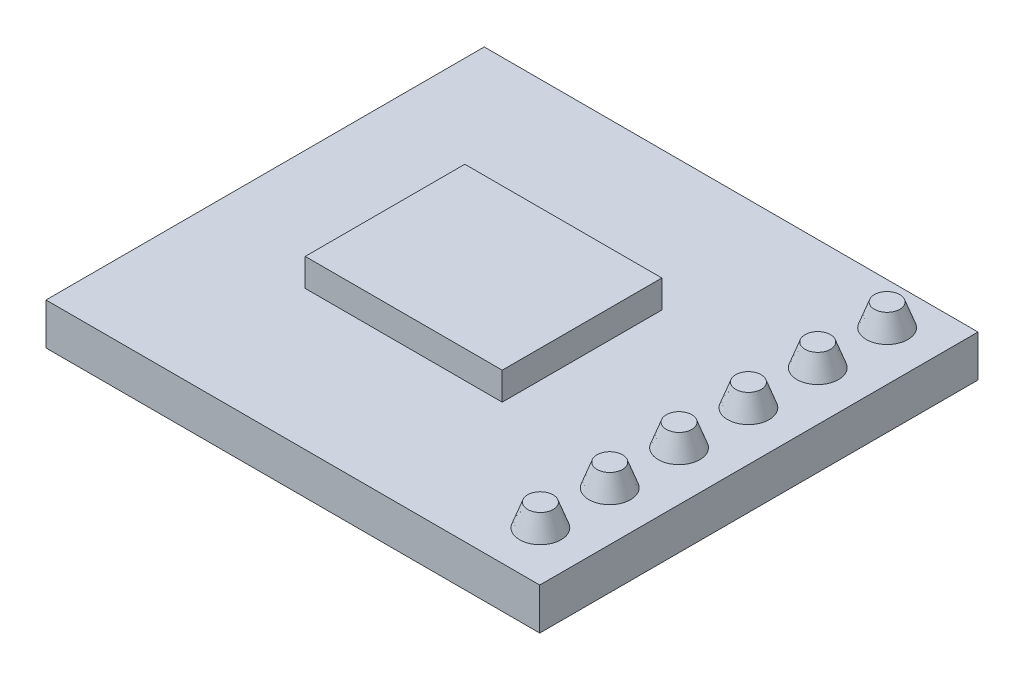
from build123d import *

# Parameters (mm, degrees)
SKETCH1_W                     = 17.8
SKETCH1_H                     = 15.8
BOSS_EXTRUDE1_DEPTH           = 1.5
SKETCH2_W                     = 7.103176806
SKETCH2_H                     = 5.754981775
BOSS_EXTRUDE2_DEPTH           = 1
SKETCH3_R                     = 0.75
BOSS_EXTRUDE3_DEPTH           = 0.8
BOSS_EXTRUDE3_DRAFT           = 20
BOSS_EXTRUDE3_PROFILE_2_DEPTH = 0.8
BOSS_EXTRUDE3_PROFILE_2_DRAFT = 20
BOSS_EXTRUDE3_PROFILE_3_DEPTH = 0.8
BOSS_EXTRUDE3_PROFILE_3_DRAFT = 20
BOSS_EXTRUDE3_PROFILE_4_DEPTH = 0.8
BOSS_EXTRUDE3_PROFILE_4_DRAFT = 20
BOSS_EXTRUDE3_PROFILE_5_DEPTH = 0.8
BOSS_EXTRUDE3_PROFILE_5_DRAFT = 20
BOSS_EXTRUDE3_PROFILE_6_DEPTH = 0.8
BOSS_EXTRUDE3_PROFILE_6_DRAFT = 20


with BuildPart() as part:
    # Sketch1 → Boss-Extrude1 (new body)
    with BuildSketch(Plane(origin=(0, 0, 0), x_dir=(1, 0, 0), z_dir=(0, 1, 0))):
        Rectangle(SKETCH1_W, SKETCH1_H)
    extrude(amount=BOSS_EXTRUDE1_DEPTH)

    # Sketch2 → Boss-Extrude2 (add)
    with BuildSketch(Plane(origin=(0, 1.5, 0), x_dir=(1, 0, 0), z_dir=(0, 1, 0))):
        with Locations((-1.036299166, 0.010061156)):
            Rectangle(SKETCH2_W, SKETCH2_H)
    extrude(amount=BOSS_EXTRUDE2_DEPTH)


with BuildPart() as boss_extrude3_tool:
    # Sketch3 → Boss-Extrude3 (with draft: the straight prism first)
    with BuildSketch(Plane(origin=(0, 1.5, 0), x_dir=(1, 0, 0), z_dir=(0, 1, 0))):
        with Locations((7.12329912, 6.4)):
            Circle(SKETCH3_R)
    extrude(amount=BOSS_EXTRUDE3_DEPTH)
    # Boss-Extrude3: the draft: its side faces are tilted about the plane it starts from
    boss_extrude3_sides = [boss_extrude3_tool.faces().sort_by_distance(p)[0] for p in [
        (6.37329912, 1.9, -6.4),
    ]]
    draft(boss_extrude3_sides, Plane(origin=(0, 1.5, 0), x_dir=(1, 0, 0), z_dir=(0, 1, 0)), BOSS_EXTRUDE3_DRAFT)


with BuildPart() as part_1:
    add(part.part)

    # Boss-Extrude3: add boss_extrude3_tool
    add(boss_extrude3_tool.part)


with BuildPart() as boss_extrude3_profile_2_tool:
    # Sketch3 → Boss-Extrude3 profile 2 (with draft: the straight prism first)
    with BuildSketch(Plane(origin=(0, 1.5, 0), x_dir=(1, 0, 0), z_dir=(0, 1, 0))):
        with Locations((7.12329912, 3.9)):
            Circle(SKETCH3_R)
    extrude(amount=BOSS_EXTRUDE3_PROFILE_2_DEPTH)
    # Boss-Extrude3 profile 2: the draft: its side faces are tilted about the plane it starts from
    boss_extrude3_profile_2_sides = [boss_extrude3_profile_2_tool.faces().sort_by_distance(p)[0] for p in [
        (6.37329912, 1.9, -3.9),
    ]]
    draft(boss_extrude3_profile_2_sides, Plane(origin=(0, 1.5, 0), x_dir=(1, 0, 0), z_dir=(0, 1, 0)), BOSS_EXTRUDE3_PROFILE_2_DRAFT)


with BuildPart() as part_2:
    add(part_1.part)

    # Boss-Extrude3 profile 2: add boss_extrude3_profile_2_tool
    add(boss_extrude3_profile_2_tool.part)


with BuildPart() as boss_extrude3_profile_3_tool:
    # Sketch3 → Boss-Extrude3 profile 3 (with draft: the straight prism first)
    with BuildSketch(Plane(origin=(0, 1.5, 0), x_dir=(1, 0, 0), z_dir=(0, 1, 0))):
        with Locations((7.12329912, 1.4)):
            Circle(SKETCH3_R)
    extrude(amount=BOSS_EXTRUDE3_PROFILE_3_DEPTH)
    # Boss-Extrude3 profile 3: the draft: its side faces are tilted about the plane it starts from
    boss_extrude3_profile_3_sides = [boss_extrude3_profile_3_tool.faces().sort_by_distance(p)[0] for p in [
        (6.37329912, 1.9, -1.4),
    ]]
    draft(boss_extrude3_profile_3_sides, Plane(origin=(0, 1.5, 0), x_dir=(1, 0, 0), z_dir=(0, 1, 0)), BOSS_EXTRUDE3_PROFILE_3_DRAFT)


with BuildPart() as part_3:
    add(part_2.part)

    # Boss-Extrude3 profile 3: add boss_extrude3_profile_3_tool
    add(boss_extrude3_profile_3_tool.part)


with BuildPart() as boss_extrude3_profile_4_tool:
    # Sketch3 → Boss-Extrude3 profile 4 (with draft: the straight prism first)
    with BuildSketch(Plane(origin=(0, 1.5, 0), x_dir=(1, 0, 0), z_dir=(0, 1, 0))):
        with Locations((7.12329912, -1.1)):
            Circle(SKETCH3_R)
    extrude(amount=BOSS_EXTRUDE3_PROFILE_4_DEPTH)
    # Boss-Extrude3 profile 4: the draft: its side faces are tilted about the plane it starts from
    boss_extrude3_profile_4_sides = [boss_extrude3_profile_4_tool.faces().sort_by_distance(p)[0] for p in [
        (6.37329912, 1.9, 1.1),
    ]]
    draft(boss_extrude3_profile_4_sides, Plane(origin=(0, 1.5, 0), x_dir=(1, 0, 0), z_dir=(0, 1, 0)), BOSS_EXTRUDE3_PROFILE_4_DRAFT)


with BuildPart() as part_4:
    add(part_3.part)

    # Boss-Extrude3 profile 4: add boss_extrude3_profile_4_tool
    add(boss_extrude3_profile_4_tool.part)


with BuildPart() as boss_extrude3_profile_5_tool:
    # Sketch3 → Boss-Extrude3 profile 5 (with draft: the straight prism first)
    with BuildSketch(Plane(origin=(0, 1.5, 0), x_dir=(1, 0, 0), z_dir=(0, 1, 0))):
        with Locations((7.12329912, -3.6)):
            Circle(SKETCH3_R)
    extrude(amount=BOSS_EXTRUDE3_PROFILE_5_DEPTH)
    # Boss-Extrude3 profile 5: the draft: its side faces are tilted about the plane it starts from
    boss_extrude3_profile_5_sides = [boss_extrude3_profile_5_tool.faces().sort_by_distance(p)[0] for p in [
        (6.37329912, 1.9, 3.6),
    ]]
    draft(boss_extrude3_profile_5_sides, Plane(origin=(0, 1.5, 0), x_dir=(1, 0, 0), z_dir=(0, 1, 0)), BOSS_EXTRUDE3_PROFILE_5_DRAFT)


with BuildPart() as part_5:
    add(part_4.part)

    # Boss-Extrude3 profile 5: add boss_extrude3_profile_5_tool
    add(boss_extrude3_profile_5_tool.part)


with BuildPart() as boss_extrude3_profile_6_tool:
    # Sketch3 → Boss-Extrude3 profile 6 (with draft: the straight prism first)
    with BuildSketch(Plane(origin=(0, 1.5, 0), x_dir=(1, 0, 0), z_dir=(0, 1, 0))):
        with Locations((7.12329912, -6.1)):
            Circle(SKETCH3_R)
    extrude(amount=BOSS_EXTRUDE3_PROFILE_6_DEPTH)
    # Boss-Extrude3 profile 6: the draft: its side faces are tilted about the plane it starts from
    boss_extrude3_profile_6_sides = [boss_extrude3_profile_6_tool.faces().sort_by_distance(p)[0] for p in [
        (6.37329912, 1.9, 6.1),
    ]]
    draft(boss_extrude3_profile_6_sides, Plane(origin=(0, 1.5, 0), x_dir=(1, 0, 0), z_dir=(0, 1, 0)), BOSS_EXTRUDE3_PROFILE_6_DRAFT)


with BuildPart() as part_6:
    add(part_5.part)

    # Boss-Extrude3 profile 6: add boss_extrude3_profile_6_tool
    add(boss_extrude3_profile_6_tool.part)


solid = part_6.part
